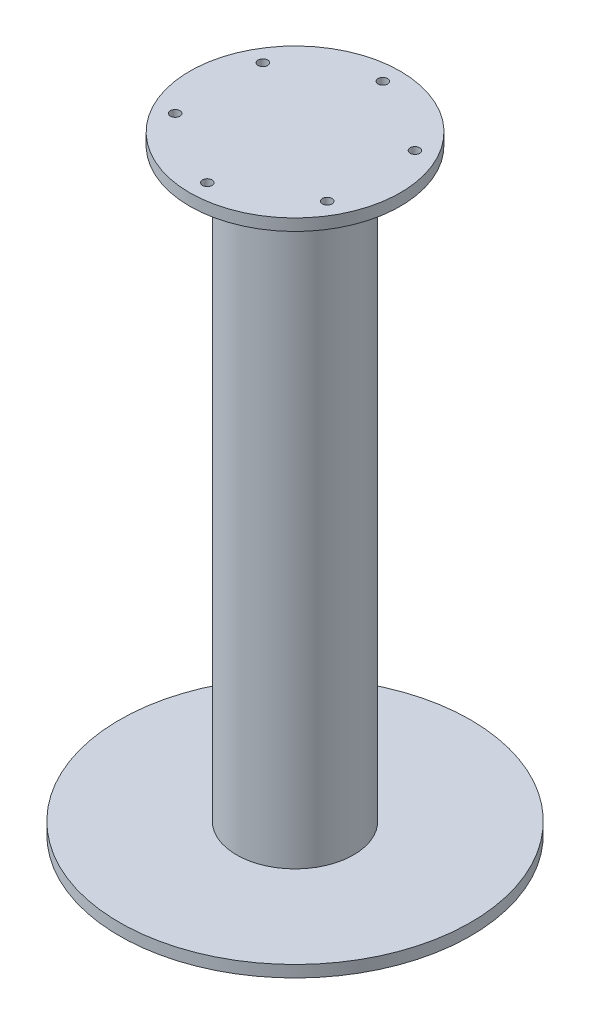
from build123d import *

# Parameters (mm, degrees)
SKETCH_1_R      = 90
SKETCH_1_R_2    = 4.1
EXTRUDE_1_DEPTH = 10
SKETCH_2_R      = 50
EXTRUDE_2_DEPTH = 500
SKETCH_3_R      = 150
EXTRUDE_3_DEPTH = 10


with BuildPart() as part:
    # 草图1 → 凸台-拉伸1 (new body)
    with BuildSketch(Plane(origin=(0, 0, 0), x_dir=(1, 0, 0), z_dir=(0, 1, 0))):
        with Locations(Location((0, 0, 0), (0, 0, 270))):
            Circle(SKETCH_1_R)
        with Locations(Location((0, -75, 0), (0, 0, 270))):
            Circle(SKETCH_1_R_2, mode=Mode.SUBTRACT)
        with Locations(Location((-64.951905284, -37.5, 0), (0, 0, 270))):
            Circle(SKETCH_1_R_2, mode=Mode.SUBTRACT)
        with Locations(Location((-64.951905284, 37.5, 0), (0, 0, 270))):
            Circle(SKETCH_1_R_2, mode=Mode.SUBTRACT)
        with Locations(Location((0, 75, 0), (0, 0, 270))):
            Circle(SKETCH_1_R_2, mode=Mode.SUBTRACT)
        with Locations(Location((64.951905284, 37.5, 0), (0, 0, 270))):
            Circle(SKETCH_1_R_2, mode=Mode.SUBTRACT)
        with Locations(Location((64.951905284, -37.5, 0), (0, 0, 270))):
            Circle(SKETCH_1_R_2, mode=Mode.SUBTRACT)
    extrude(amount=EXTRUDE_1_DEPTH)

    # 草图2 → 凸台-拉伸2 (add)
    with BuildSketch(Plane.XZ):
        with Locations(Location((0, 0, 0), (0, 0, 270))):
            Circle(SKETCH_2_R)
    extrude(amount=EXTRUDE_2_DEPTH)

    # 草图3 → 凸台-拉伸3 (add)
    with BuildSketch(Plane.XZ.offset(500)):
        with Locations(Location((0, 0, 0), (0, 0, 270))):
            Circle(SKETCH_3_R)
    extrude(amount=EXTRUDE_3_DEPTH)


solid = part.part
